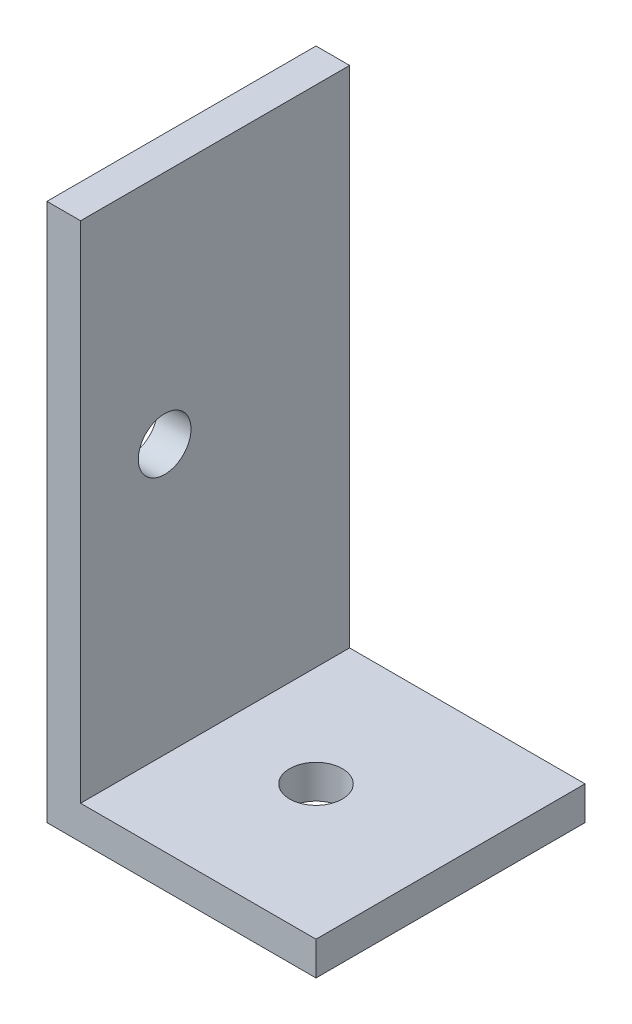
from build123d import *

# Parameters (mm, degrees)
BOSS_EXTRUDE1_DEPTH = 12.7
SKETCH2_R           = 2.4892
CUT_EXTRUDE1_DEPTH  = 56.448991199
SKETCH3_R           = 2.4892
CUT_EXTRUDE2_DEPTH  = 57.884801353


with BuildPart() as part:
    # Sketch1 → Boss-Extrude1 (new, symmetric)
    with BuildSketch(Plane.XY):
        Polygon((0, 0), (0, 50.8), (3.175, 50.8), (3.175, 3.175), (25.4, 3.175), (25.4, 0), align=None)
    extrude(amount=BOSS_EXTRUDE1_DEPTH, both=True)

    # Sketch2 → Cut-Extrude1 (cut, through all)
    with BuildSketch(Plane(origin=(0, 3.175, 0), x_dir=(1, 0, 0), z_dir=(0, 1, 0))):
        with Locations(Location((12.7, 0, 0), (0, 0, 180))):
            Circle(SKETCH2_R)
    extrude(amount=-CUT_EXTRUDE1_DEPTH, mode=Mode.SUBTRACT)

    # Sketch3 → Cut-Extrude2 (cut, through all)
    with BuildSketch(Plane(origin=(3.175, 0, 0), x_dir=(0, 0, -1), z_dir=(1, 0, 0))):
        with Locations(Location((-4.7625, 28.575, 0), (0, 0, 90))):
            Circle(SKETCH3_R)
    extrude(amount=-CUT_EXTRUDE2_DEPTH, mode=Mode.SUBTRACT)


solid = part.part
